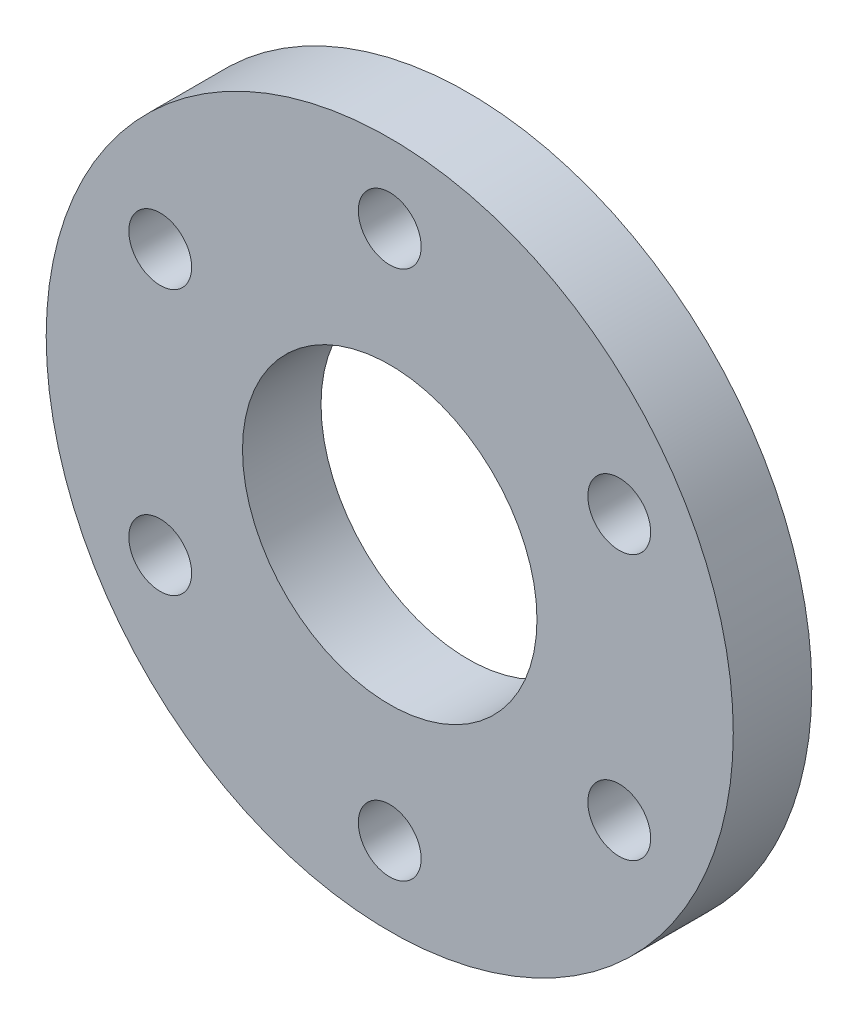
from build123d import *

# Parameters (mm, degrees)
SKETCH_1_R      = 17.5
SKETCH_1_R_2    = 7.5
SKETCH_1_R_3    = 1.6
EXTRUDE_1_DEPTH = 4


with BuildPart() as part:
    # 草图1 → 凸台-拉伸1 (new body)
    with BuildSketch(Plane.XY):
        Circle(SKETCH_1_R)
        Circle(SKETCH_1_R_2, mode=Mode.SUBTRACT)
        with Locations((0, 13.5)):
            Circle(SKETCH_1_R_3, mode=Mode.SUBTRACT)
        with Locations((11.691342951, 6.75)):
            Circle(SKETCH_1_R_3, mode=Mode.SUBTRACT)
        with Locations((11.691342951, -6.75)):
            Circle(SKETCH_1_R_3, mode=Mode.SUBTRACT)
        with Locations((0, -13.5)):
            Circle(SKETCH_1_R_3, mode=Mode.SUBTRACT)
        with Locations((-11.691342951, -6.75)):
            Circle(SKETCH_1_R_3, mode=Mode.SUBTRACT)
        with Locations((-11.691342951, 6.75)):
            Circle(SKETCH_1_R_3, mode=Mode.SUBTRACT)
    extrude(amount=EXTRUDE_1_DEPTH)


solid = part.part
